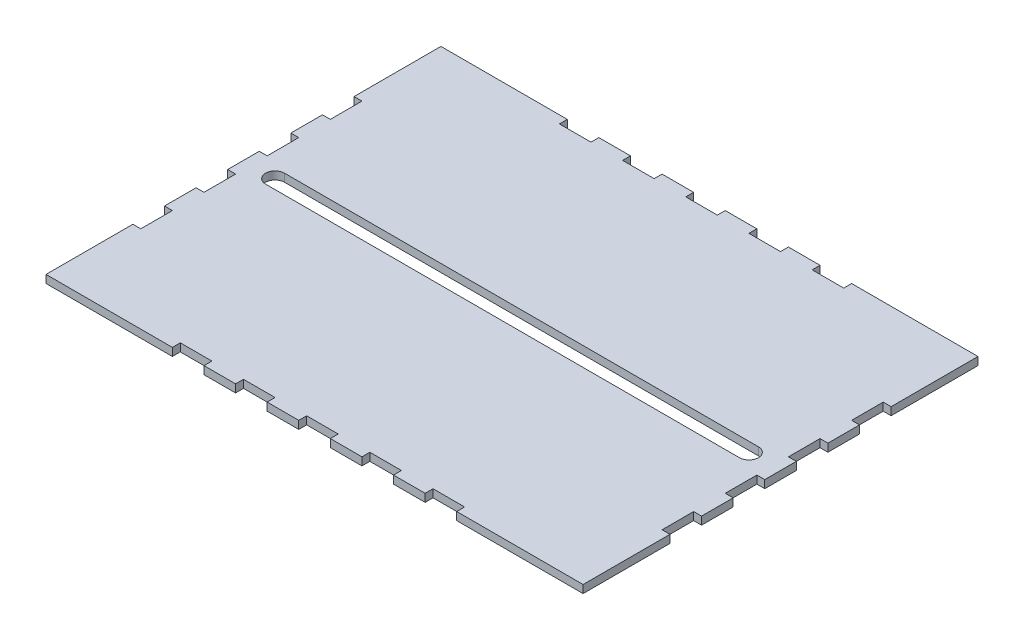
from build123d import *

# Parameters (mm, degrees)
BOSS_EXTRUDE1_DEPTH = 1.5875
CUT_EXTRUDE1_DEPTH  = 152.481733807


with BuildPart() as part:
    # Sketch1 → Boss-Extrude1 (new, symmetric)
    with BuildSketch(Plane(origin=(0, 0, 0), x_dir=(1, 0, 0), z_dir=(0, 1, 0))):
        Polygon((-122.014602546, 89.716619519), (-71.214602546, 89.716619519), (-71.214602546, 86.541619519), (-58.514602546, 86.541619519), (-58.514602546, 89.716619519), (-45.814602546, 89.716619519), (-45.814602546, 86.541619519), (-33.114602546, 86.541619519), (-33.114602546, 89.716619519), (-20.414602546, 89.716619519), (-20.414602546, 86.541619519), (-7.714602546, 86.541619519), (-7.714602546, 89.716619519), (4.985397454, 89.716619519), (4.985397454, 86.541619519), (17.685397454, 86.541619519), (17.685397454, 89.716619519), (30.385397454, 89.716619519), (30.385397454, 86.541619519), (43.085397454, 86.541619519), (43.085397454, 89.716619519), (93.885397454, 89.716619519), (93.885397454, 54.791619519), (90.710397454, 54.791619519), (90.710397454, 42.091619519), (93.885397454, 42.091619519), (93.885397454, 29.391619519), (90.710397454, 29.391619519), (90.710397454, 16.691619519), (93.885397454, 16.691619519), (93.885397454, 3.991619519), (90.710397454, 3.991619519), (90.710397454, -8.708380481), (93.885397454, -8.708380481), (93.885397454, -21.408380481), (90.710397454, -21.408380481), (90.710397454, -34.108380481), (93.885397454, -34.108380481), (93.885397454, -69.033380481), (43.085397454, -69.033380481), (43.085397454, -65.858380481), (30.385397454, -65.858380481), (30.385397454, -69.033380481), (17.685397454, -69.033380481), (17.685397454, -65.858380481), (4.985397454, -65.858380481), (4.985397454, -69.033380481), (-7.714602546, -69.033380481), (-7.714602546, -65.858380481), (-20.414602546, -65.858380481), (-20.414602546, -69.033380481), (-33.114602546, -69.033380481), (-33.114602546, -65.858380481), (-45.814602546, -65.858380481), (-45.814602546, -69.033380481), (-58.514602546, -69.033380481), (-58.514602546, -65.858380481), (-71.214602546, -65.858380481), (-71.214602546, -69.033380481), (-122.014602546, -69.033380481), (-122.014602546, -34.108380481), (-118.839602546, -34.108380481), (-118.839602546, -21.408380481), (-122.014602546, -21.408380481), (-122.014602546, -8.708380481), (-118.839602546, -8.708380481), (-118.839602546, 3.991619519), (-122.014602546, 3.991619519), (-122.014602546, 16.691619519), (-118.839602546, 16.691619519), (-118.839602546, 29.391619519), (-122.014602546, 29.391619519), (-122.014602546, 42.091619519), (-118.839602546, 42.091619519), (-118.839602546, 54.791619519), (-122.014602546, 54.791619519), align=None)
    extrude(amount=BOSS_EXTRUDE1_DEPTH, both=True)

    # Sketch2 → Cut-Extrude1 (cut, through all)
    with BuildSketch(Plane(origin=(0, 1.5875, 0), x_dir=(1, 0, 0), z_dir=(0, 1, 0))):
        with BuildLine():
            Line((81.185397454, 6.531619519), (-109.314602546, 6.531619519))
            ThreePointArc((-109.314602546, 6.531619519), (-113.124602546, 10.341619519), (-109.314602546, 14.151619519))
            Line((-109.314602546, 14.151619519), (81.185397454, 14.151619519))
            ThreePointArc((81.185397454, 14.151619519), (84.995397454, 10.341619519), (81.185397454, 6.531619519))
        make_face()
    extrude(amount=-CUT_EXTRUDE1_DEPTH, mode=Mode.SUBTRACT)


solid = part.part
